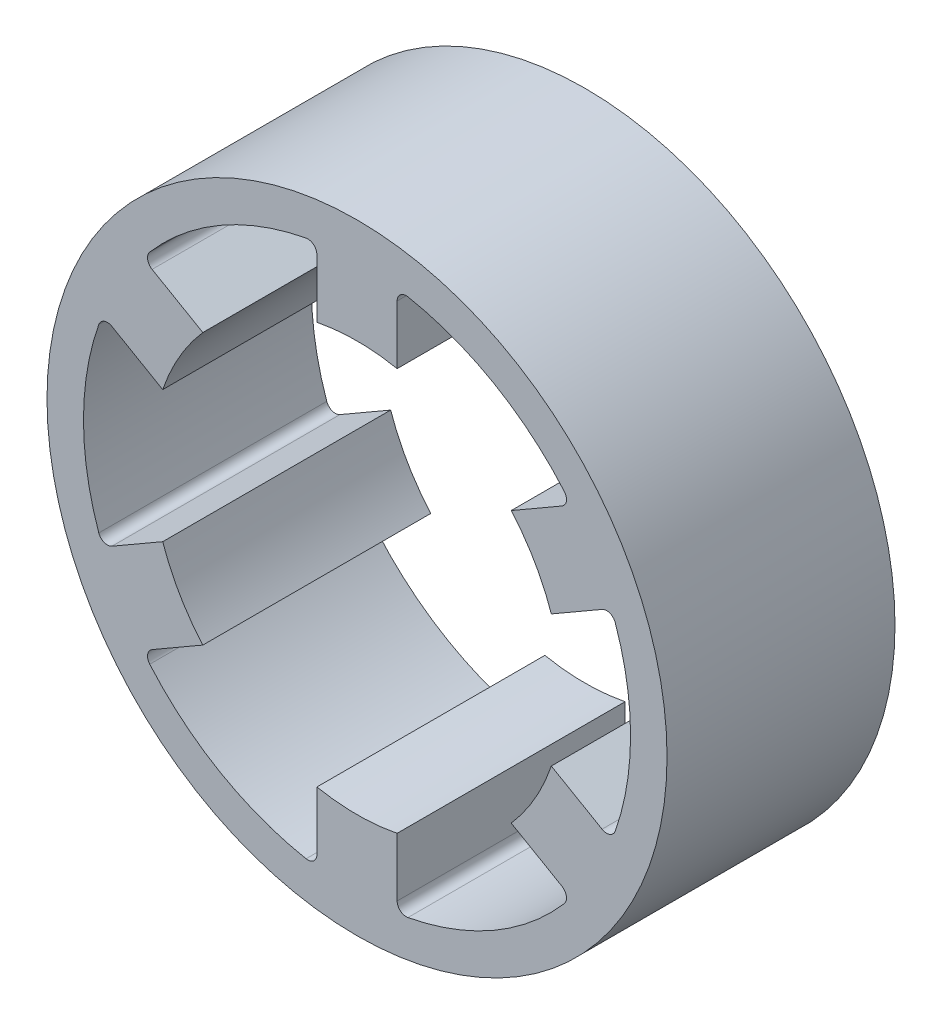
from build123d import *

# Parameters (mm, degrees)
SKETCH_1_W                       = 50
SKETCH_1_H                       = 23
CUT_EXTRUDE_1_DEPTH              = 109.388191239
FILLET_1_R                       = 2
PATTERN_CIRCULAR_1_COUNT         = 6
FILLET_1_OF_PATTERN_CIRCULAR_1_R = 2


with BuildPart() as part:
    # Эскиз1 → Повернуть1 (revolve)
    with BuildSketch(Plane(origin=(0, 0, 0), x_dir=(0, 0, -1), z_dir=(1, 0, 0)), mode=Mode.PRIVATE) as revolve_1_sk:
        with Locations((25, 56.5)):
            Rectangle(SKETCH_1_W, SKETCH_1_H)
    revolve(revolve_1_sk.sketch.rotate(Axis((0, 0, 0), (0, 0, -1)), 90), axis=Axis((0, 0, 0), (0, 0, -1)))

    # Эскиз2 → Вырез-Вытянуть1 (cut, through all)
    with BuildSketch(Plane.XY):
        with BuildLine():
            Line((-8.8, 59.351158371), (-8.8, 44.131168124))
            ThreePointArc((-8.8, 44.131168124), (-15.861240947, 42.112005837), (-22.5, 38.97114317))
            Line((-22.5, 38.97114317), (-30, 51.961524227))
            ThreePointArc((-30, 51.961524227), (-19.748713204, 56.65675888), (-8.8, 59.351158371))
        make_face()
        with BuildLine():
            Line((8.8, 59.351158371), (8.8, 44.131168124))
            ThreePointArc((8.8, 44.131168124), (15.861240947, 42.112005837), (22.5, 38.97114317))
            Line((22.5, 38.97114317), (30, 51.961524227))
            ThreePointArc((30, 51.961524227), (19.748713204, 56.65675888), (8.8, 59.351158371))
        make_face()
    cut_extrude_1 = extrude(amount=-CUT_EXTRUDE_1_DEPTH, mode=Mode.SUBTRACT)

    # Скругление1
    fillet_1_edges = [part.edges().sort_by_distance(p)[0] for p in [
        (-8.8, 59.351158371, -25),
        (8.8, 59.351158371, -25),
    ]]
    fillet(fillet_1_edges, radius=FILLET_1_R)

    # Круговой массив1: Вырез-Вытянуть1 ×6 about axis
    pattern_circular_1_axis = Axis((0, 0, 0), (0, 0, 1))
    for i in range(1, PATTERN_CIRCULAR_1_COUNT):
        add(cut_extrude_1.rotate(pattern_circular_1_axis, i * 360 / PATTERN_CIRCULAR_1_COUNT), mode=Mode.SUBTRACT)

    # Скругление1 of Круговой массив1
    fillet_1_of_pattern_circular_1_edges = [part.edges().sort_by_distance(p)[0] for p in [
        (-55.799610893, 22.054555632, -25),
        (-46.999610893, 37.296602739, -25),
        (-46.999610893, -37.296602739, -25),
        (-55.799610893, -22.054555632, -25),
        (8.8, -59.351158371, -25),
        (-8.8, -59.351158371, -25),
        (55.799610893, -22.054555632, -25),
        (46.999610893, -37.296602739, -25),
        (46.999610893, 37.296602739, -25),
        (55.799610893, 22.054555632, -25),
    ]]
    fillet(fillet_1_of_pattern_circular_1_edges, radius=FILLET_1_OF_PATTERN_CIRCULAR_1_R)


solid = part.part
